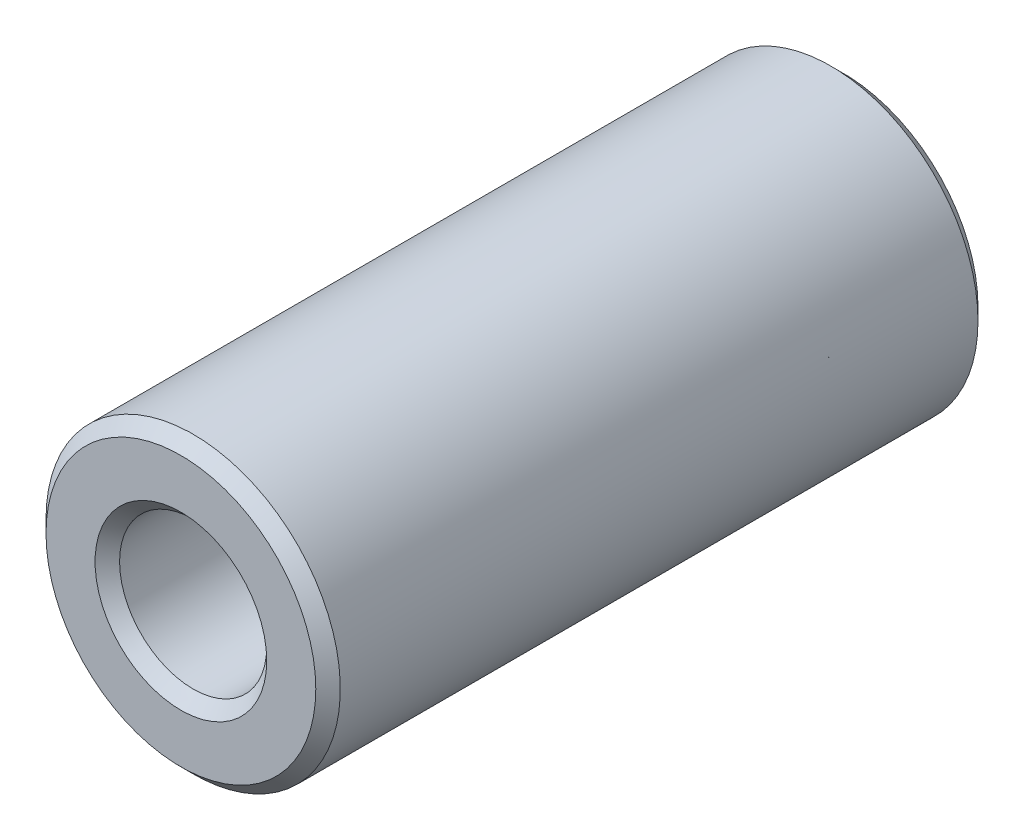
from build123d import *

# Parameters (mm, degrees)
ESQUISSE1_R          = 6
ESQUISSE1_R_2        = 3
BASE_EXTRUSION_DEPTH = 27
CHANFREIN1_SIZE      = 0.5


with BuildPart() as part:
    # Esquisse1 → Base-Extrusion (new body)
    with BuildSketch(Plane.XY):
        with Locations(Location((0, 0, 0), (0, 0, 180))):
            Circle(ESQUISSE1_R)
        with Locations(Location((0, 0, 0), (0, 0, 180))):
            Circle(ESQUISSE1_R_2, mode=Mode.SUBTRACT)
    extrude(amount=BASE_EXTRUSION_DEPTH)

    # Chanfrein1
    chanfrein1_edges = [part.edges().sort_by_distance(p)[0] for p in [
        (6, 0, 0),
        (6, 0, 27),
        (3, 0, 0),
        (3, 0, 27),
    ]]
    chamfer(chanfrein1_edges, length=CHANFREIN1_SIZE)


solid = part.part
